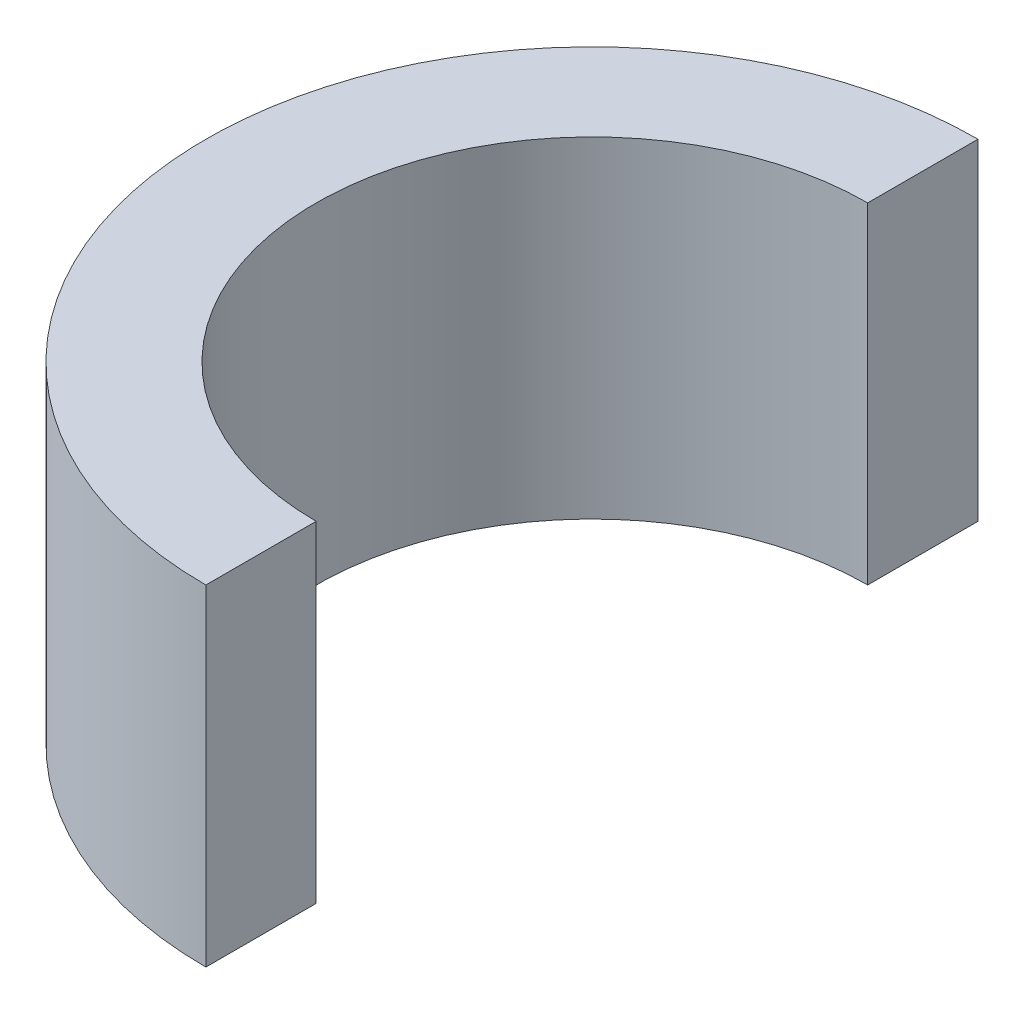
from build123d import *

# Parameters (mm, degrees)
EXTRUDE_1_DEPTH = 6


with BuildPart() as part:
    # 草图1 → 凸台-拉伸1 (new body)
    with BuildSketch(Plane(origin=(0, 0, 0), x_dir=(1, 0, 0), z_dir=(0, 1, 0))):
        with BuildLine():
            Line((0, 5), (0, 7))
            ThreePointArc((0, 7), (-7, 0), (0, -7))
            Line((0, -7), (0, -5))
            ThreePointArc((0, -5), (-5, 0), (0, 5))
        make_face()
    extrude(amount=EXTRUDE_1_DEPTH)


solid = part.part
